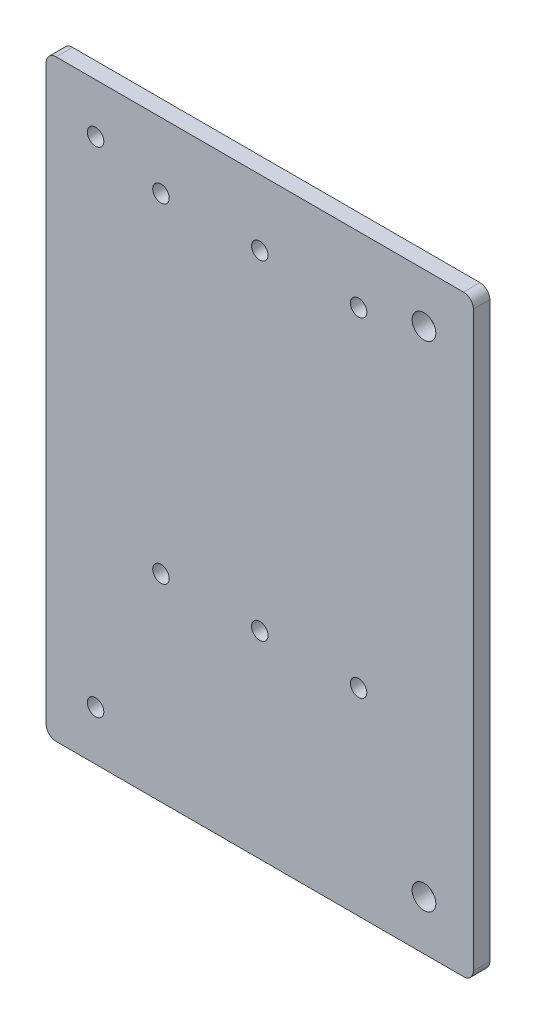
from build123d import *

# Parameters (mm, degrees)
SKETCH1_W           = 129.7
SKETCH1_H           = 180
SKETCH1_R           = 2.5
SKETCH1_R_2         = 3.6
BOSS_EXTRUDE1_DEPTH = 5
FILLET1_R           = 3


with BuildPart() as part:
    # Sketch1 → Boss-Extrude1 (new body)
    with BuildSketch(Plane.XY):
        with Locations((64.85, 90)):
            Rectangle(SKETCH1_W, SKETCH1_H)
        with Locations((15, 15)):
            Circle(SKETCH1_R, mode=Mode.SUBTRACT)
        with Locations((15, 165)):
            Circle(SKETCH1_R, mode=Mode.SUBTRACT)
        with Locations((114.7, 165)):
            Circle(SKETCH1_R_2, mode=Mode.SUBTRACT)
        with Locations((114.7, 15)):
            Circle(SKETCH1_R_2, mode=Mode.SUBTRACT)
        with Locations((34.85, 160)):
            Circle(SKETCH1_R, mode=Mode.SUBTRACT)
        with Locations((64.85, 160)):
            Circle(SKETCH1_R, mode=Mode.SUBTRACT)
        with Locations((94.85, 160)):
            Circle(SKETCH1_R, mode=Mode.SUBTRACT)
        with Locations((34.85, 60)):
            Circle(SKETCH1_R, mode=Mode.SUBTRACT)
        with Locations((64.85, 60)):
            Circle(SKETCH1_R, mode=Mode.SUBTRACT)
        with Locations((94.85, 60)):
            Circle(SKETCH1_R, mode=Mode.SUBTRACT)
    extrude(amount=BOSS_EXTRUDE1_DEPTH)

    # Fillet1
    fillet1_edges = [part.edges().sort_by_distance(p)[0] for p in [
        (0, 180, 2.5),
        (129.7, 180, 2.5),
        (129.7, 0, 2.5),
        (0, 0, 2.5),
    ]]
    fillet(fillet1_edges, radius=FILLET1_R)


solid = part.part
